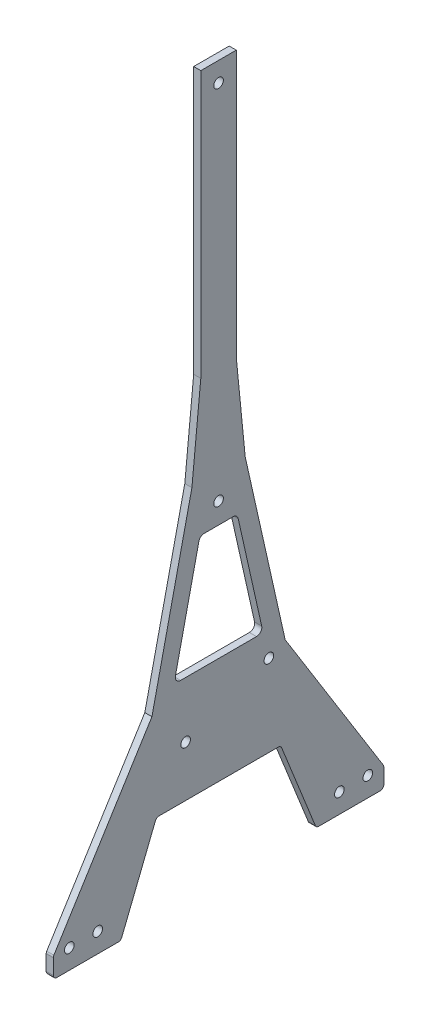
from build123d import *

# Parameters (mm, degrees)
SKETCH_1_R          = 2.7
EXTRUDE_1_DEPTH     = 4
CUT_EXTRUDE_1_REACH = 414.179
FILLET_1_R          = 3
FILLET_2_R          = 2


with BuildPart() as part:
    # 草圖1 → 填料-伸長1 (new body)
    with BuildSketch(Plane(origin=(0, 0, 0), x_dir=(0, 0, -1), z_dir=(1, 0, 0))):
        Polygon((-55, 0), (-35, 50), (35, 50), (55, 0), (93, 0), (93, 11.24256), (37.5, 100.38), (15, 200.76), (10, 251.53), (10, 401.53), (-10, 401.53), (-10, 251.53), (-15, 200.76), (-37.5, 100.38), (-93, 11.24256), (-93, 0), align=None)
        with Locations((28.317422225, 96.006946316)):
            Circle(SKETCH_1_R, mode=Mode.SUBTRACT)
        with Locations((-18.525349225, 78.521101672)):
            Circle(SKETCH_1_R, mode=Mode.SUBTRACT)
        with Locations((68, 11)):
            Circle(SKETCH_1_R, mode=Mode.SUBTRACT)
        with Locations((84, 11)):
            Circle(SKETCH_1_R, mode=Mode.SUBTRACT)
        with Locations((-84, 11)):
            Circle(SKETCH_1_R, mode=Mode.SUBTRACT)
        with Locations((-68, 11)):
            Circle(SKETCH_1_R, mode=Mode.SUBTRACT)
        with Locations((0, 186.76)):
            Circle(SKETCH_1_R, mode=Mode.SUBTRACT)
        with Locations((0, 390.53)):
            Circle(SKETCH_1_R, mode=Mode.SUBTRACT)
    extrude(amount=EXTRUDE_1_DEPTH)

    # 草圖3 → 除料-伸長1 (cut, up to next)
    with BuildSketch(Plane(origin=(4, 0, 0), x_dir=(0, 0, -1), z_dir=(1, 0, 0)), mode=Mode.PRIVATE) as cut_extrude_1_sk1:
        Polygon((-10.525924933, 175), (-25.095560318, 110), (25.095560318, 110), (10.525924933, 175), align=None)
    cut_extrude_1_tool1 = extrude(cut_extrude_1_sk1.sketch, amount=-CUT_EXTRUDE_1_REACH, mode=Mode.PRIVATE) & part.part
    add(cut_extrude_1_tool1.solids().sort_by_distance((4, 138.06903, 0))[0], mode=Mode.SUBTRACT)

    # 圓角1
    fillet_1_edges = [part.edges().sort_by_distance(p)[0] for p in [
        (2, 175, 10.525924933),
        (2, 175, -10.525924933),
        (2, 110, -25.095560318),
        (2, 110, 25.095560318),
    ]]
    fillet(fillet_1_edges, radius=FILLET_1_R)

    # 圓角2
    fillet_2_edges = [part.edges().sort_by_distance(p)[0] for p in [
        (2, 11.24256, -93),
        (2, 0, -93),
        (2, 0, -55),
        (2, 50, -35),
        (2, 50, 35),
        (2, 0, 55),
        (2, 0, 93),
        (2, 11.24256, 93),
    ]]
    fillet(fillet_2_edges, radius=FILLET_2_R)


solid = part.part
